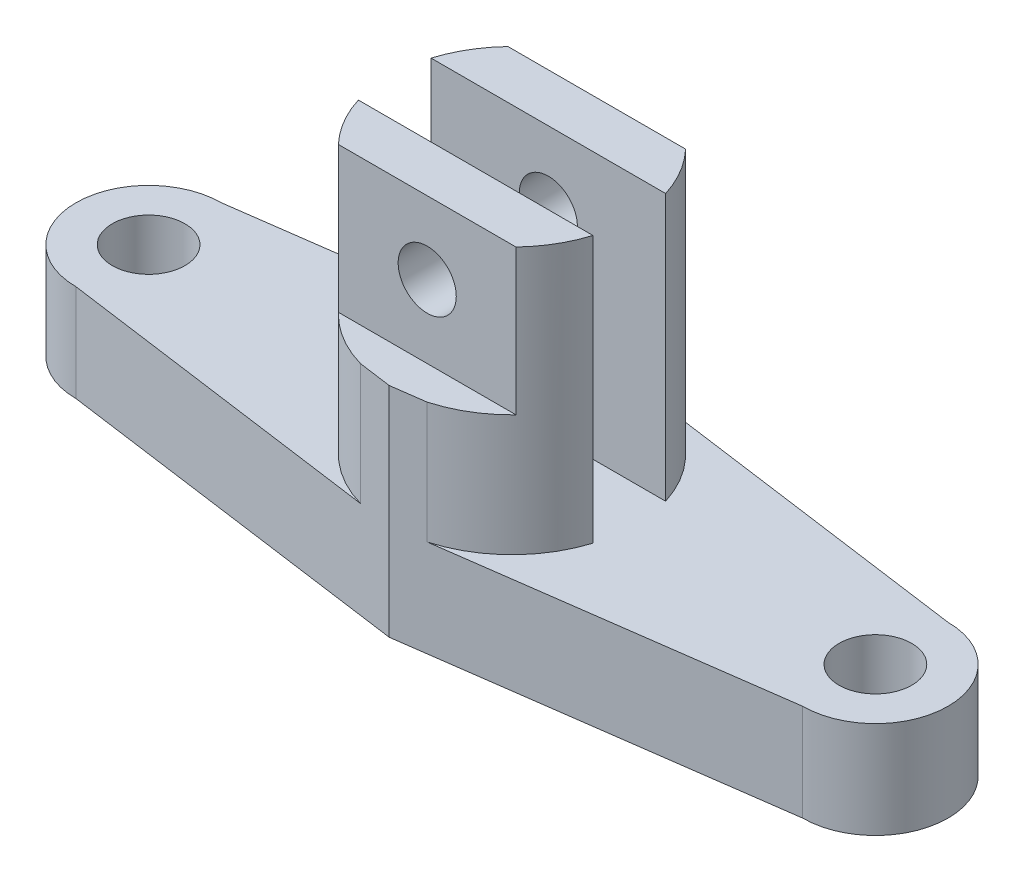
from build123d import *

# Parameters (mm, degrees)
CROQUIS_PLANTA_R           = 7.5
SALIENTE_EXTRUIR1_DEPTH    = 20
SALIENTE_EXTRUIR2_DEPTH    = 45
SALIENTE_EXTRUIR3_DEPTH    = 75
CORTAR_EXTRUIR1_DEPTH      = 125.74064428
CORTAR_EXTRUIR1_DEPTH_BACK = 125.74064428
CROQUIS14_R                = 6


with BuildPart() as part:
    # Croquis Planta → Saliente-Extruir1 (new body)
    # profile 1 of 3: a face of its own
    with BuildSketch(Plane(origin=(0, 0, 0), x_dir=(1, 0, 0), z_dir=(0, 1, 0))):
        with BuildLine():
            ThreePointArc((-6.856359495, -24.394341401), (-25.33956507, 0), (-6.856359495, 24.394341401))
            Line((-6.856359495, 24.394341401), (-75, 15))
            ThreePointArc((-75, 15), (-90, 0), (-75, -15))
            Line((-75, -15), (-6.856359495, -24.394341401))
        make_face()
        with Locations(Location((-75, 0, 0), (0, 0, 270))):
            Circle(CROQUIS_PLANTA_R, mode=Mode.SUBTRACT)
    # profile 2 of 3: a face of its own
    with BuildSketch(Plane(origin=(0, 0, 0), x_dir=(1, 0, 0), z_dir=(0, 1, 0))):
        with BuildLine():
            ThreePointArc((75, -15), (90, 0), (75, 15))
            Line((75, 15), (6.856359495, 24.394341401))
            ThreePointArc((6.856359495, 24.394341401), (20.196914684, 15.302881924), (25.33956507, 0))
            ThreePointArc((25.33956507, 0), (20.196914684, -15.302881924), (6.856359495, -24.394341401))
            Line((6.856359495, -24.394341401), (75, -15))
        make_face()
        with Locations(Location((75, 0, 0), (0, 0, 270))):
            Circle(CROQUIS_PLANTA_R, mode=Mode.SUBTRACT)
    # profile 3 of 3: a face of its own
    with BuildSketch(Plane(origin=(0, 0, 0), x_dir=(1, 0, 0), z_dir=(0, 1, 0))):
        with BuildLine():
            ThreePointArc((25.33956507, 0), (20.196914684, 15.302881924), (6.856359495, 24.394341401))
            Line((6.856359495, 24.394341401), (0, 25.33956507))
            Line((0, 25.33956507), (-6.856359495, 24.394341401))
            ThreePointArc((-6.856359495, 24.394341401), (-25.33956507, 0), (-6.856359495, -24.394341401))
            Line((-6.856359495, -24.394341401), (0, -25.33956507))
            Line((0, -25.33956507), (6.856359495, -24.394341401))
            ThreePointArc((6.856359495, -24.394341401), (20.196914684, -15.302881924), (25.33956507, 0))
        make_face()
    extrude(amount=SALIENTE_EXTRUIR1_DEPTH)

    # Croquis11 → Saliente-Extruir2 (add)
    with BuildSketch(Plane(origin=(0, 0, 0), x_dir=(1, 0, 0), z_dir=(0, 1, 0))):
        with BuildLine():
            ThreePointArc((24.204205377, 7.5), (21.845030009, 12.840880882), (18.326034976, 17.5))
            Line((18.326034976, 17.5), (-18.326034976, 17.5))
            ThreePointArc((-18.326034976, 17.5), (-21.845030009, 12.840880882), (-24.204205377, 7.5))
            Line((-24.204205377, 7.5), (24.204205377, 7.5))
        make_face()
        with BuildLine():
            ThreePointArc((18.326034976, 17.5), (13.05454839, 21.718018424), (6.856359495, 24.394341401))
            Line((6.856359495, 24.394341401), (0, 25.33956507))
            Line((0, 25.33956507), (-6.856359495, 24.394341401))
            ThreePointArc((-6.856359495, 24.394341401), (-13.05454839, 21.718018424), (-18.326034976, 17.5))
            Line((-18.326034976, 17.5), (18.326034976, 17.5))
        make_face()
        with BuildLine():
            Line((-18.326034976, -17.5), (18.326034976, -17.5))
            ThreePointArc((18.326034976, -17.5), (21.845030009, -12.840880882), (24.204205377, -7.5))
            Line((24.204205377, -7.5), (-24.204205377, -7.5))
            ThreePointArc((-24.204205377, -7.5), (-21.845030009, -12.840880882), (-18.326034976, -17.5))
        make_face()
        with BuildLine():
            Line((0, -25.33956507), (6.856359495, -24.394341401))
            ThreePointArc((6.856359495, -24.394341401), (13.05454839, -21.718018424), (18.326034976, -17.5))
            Line((18.326034976, -17.5), (-18.326034976, -17.5))
            ThreePointArc((-18.326034976, -17.5), (-13.05454839, -21.718018424), (-6.856359495, -24.394341401))
            Line((-6.856359495, -24.394341401), (0, -25.33956507))
        make_face()
    extrude(amount=SALIENTE_EXTRUIR2_DEPTH)

    # Croquis12 → Saliente-Extruir3 (add)
    with BuildSketch(Plane(origin=(0, 0, 0), x_dir=(1, 0, 0), z_dir=(0, 1, 0))):
        with BuildLine():
            ThreePointArc((24.204205377, 7.5), (21.845030009, 12.840880882), (18.326034976, 17.5))
            Line((18.326034976, 17.5), (-18.326034976, 17.5))
            ThreePointArc((-18.326034976, 17.5), (-21.845030009, 12.840880882), (-24.204205377, 7.5))
            Line((-24.204205377, 7.5), (24.204205377, 7.5))
        make_face()
        with BuildLine():
            Line((-18.326034976, -17.5), (18.326034976, -17.5))
            ThreePointArc((18.326034976, -17.5), (21.845030009, -12.840880882), (24.204205377, -7.5))
            Line((24.204205377, -7.5), (-24.204205377, -7.5))
            ThreePointArc((-24.204205377, -7.5), (-21.845030009, -12.840880882), (-18.326034976, -17.5))
        make_face()
    extrude(amount=SALIENTE_EXTRUIR3_DEPTH)

    # Croquis14 → Cortar-Extruir1 (cut, two sides: drawn at the far end of the back side and taken through both)
    with BuildSketch(Plane(origin=(0, 0, -17.5), x_dir=(-1, 0, 0), z_dir=(0, 0, -1)).offset(-CORTAR_EXTRUIR1_DEPTH_BACK)):
        with Locations((0, 60)):
            Circle(CROQUIS14_R)
    extrude(amount=CORTAR_EXTRUIR1_DEPTH + CORTAR_EXTRUIR1_DEPTH_BACK, mode=Mode.SUBTRACT)


solid = part.part
